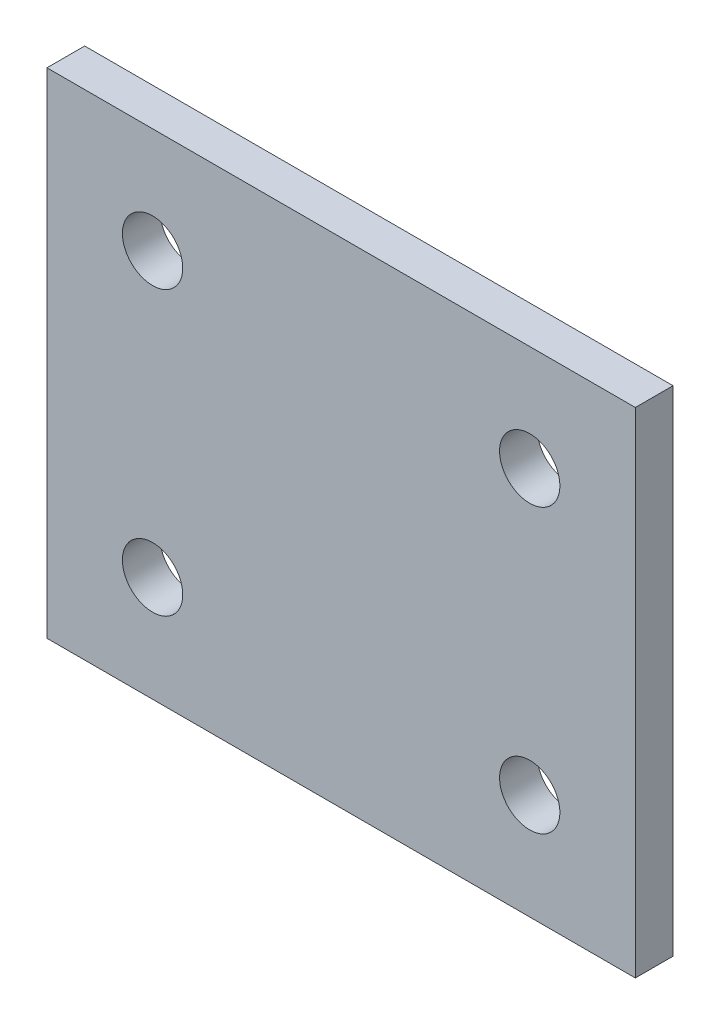
from build123d import *

# Parameters (mm, degrees)
SKETCH1_W           = 31.2
SKETCH1_H           = 26.2
SKETCH1_R           = 1.6
BOSS_EXTRUDE1_DEPTH = 2


with BuildPart() as part:
    # Sketch1 → Boss-Extrude1 (new body)
    with BuildSketch(Plane.XY):
        Rectangle(SKETCH1_W, SKETCH1_H)
        with Locations((-10, 7.5)):
            Circle(SKETCH1_R, mode=Mode.SUBTRACT)
        with Locations((10, 7.5)):
            Circle(SKETCH1_R, mode=Mode.SUBTRACT)
        with Locations((-10, -7.5)):
            Circle(SKETCH1_R, mode=Mode.SUBTRACT)
        with Locations((10, -7.5)):
            Circle(SKETCH1_R, mode=Mode.SUBTRACT)
    extrude(amount=BOSS_EXTRUDE1_DEPTH)


solid = part.part
